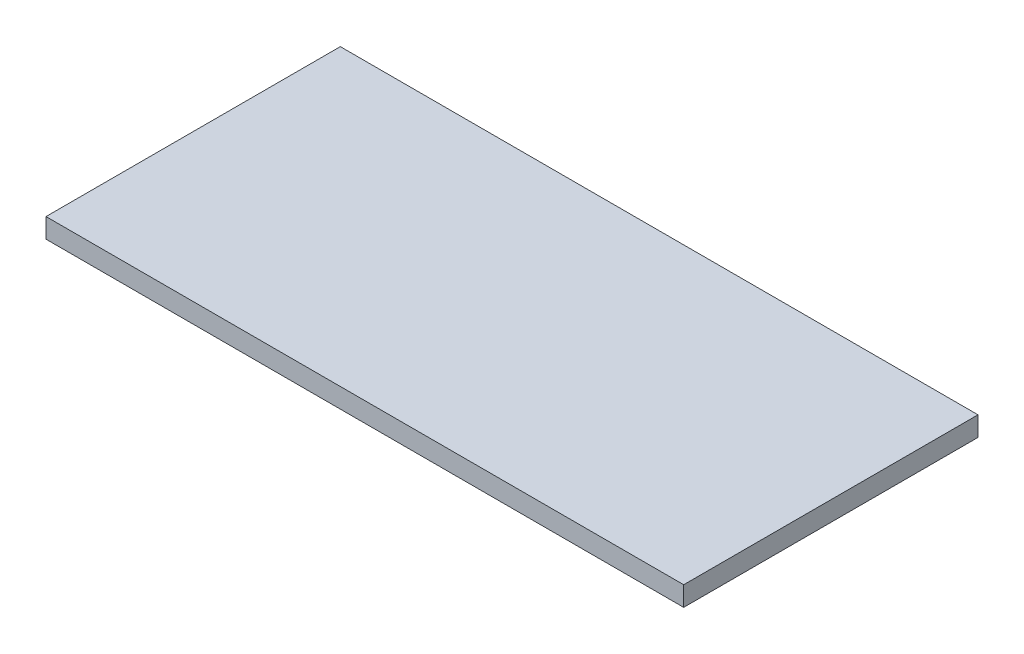
from build123d import *

# Parameters (mm, degrees)
SKETCH1_W           = 65
SKETCH1_H           = 30
BOSS_EXTRUDE1_DEPTH = 2


with BuildPart() as part:
    # Sketch1 → Boss-Extrude1 (new body)
    with BuildSketch(Plane(origin=(0, 0, 0), x_dir=(1, 0, 0), z_dir=(0, 1, 0))):
        with Locations((-32.5, -15)):
            Rectangle(SKETCH1_W, SKETCH1_H)
    extrude(amount=BOSS_EXTRUDE1_DEPTH)


solid = part.part
